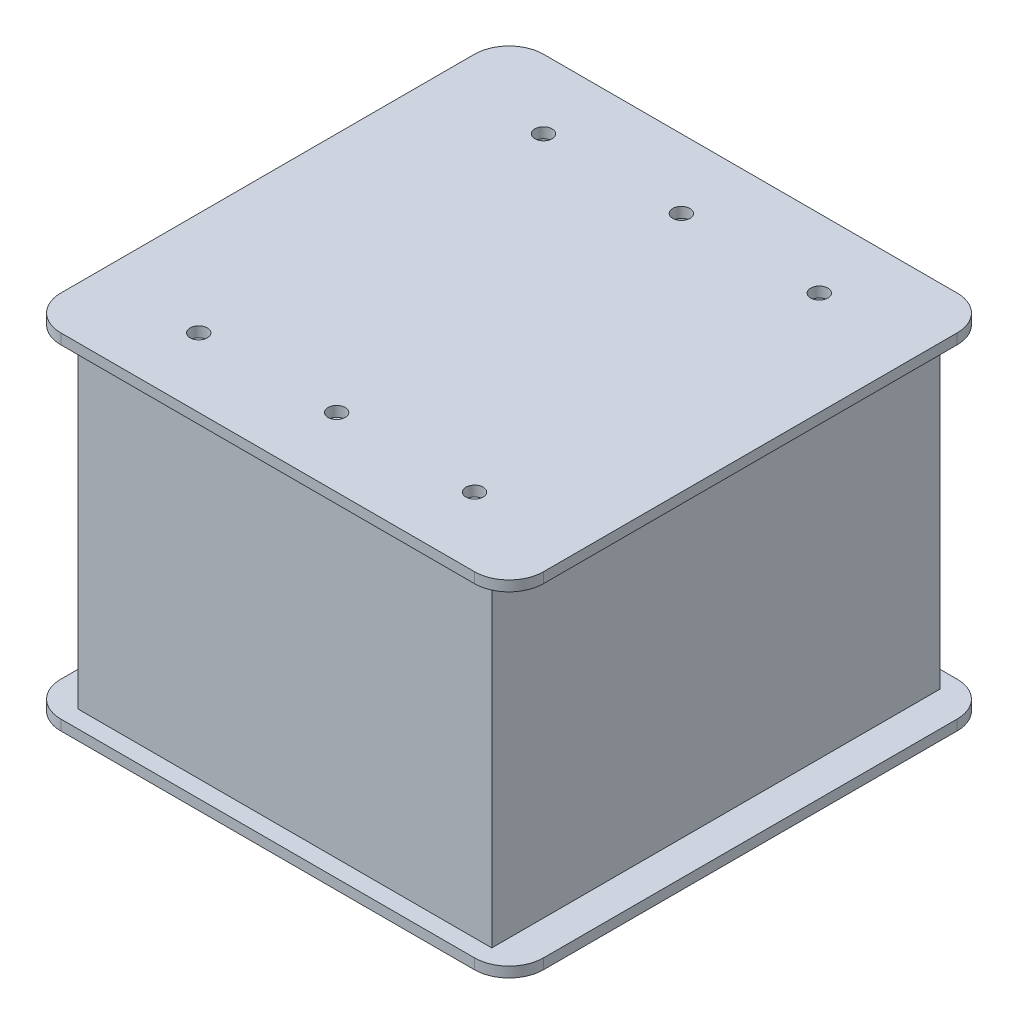
from build123d import *

# Parameters (mm, degrees)
SKETCH1_R            = 2.5
BOSS_EXTRUDE1_DEPTH  = 3
SKETCH2_W            = 120
SKETCH2_H            = 130
SKETCH2_W_2          = 114
SKETCH2_H_2          = 124
BOSS_EXTRUDE2_DEPTH  = 94
SKETCH3_R            = 2.5
BOSS_EXTRUDE3_DEPTH  = 3
BOSS_EXTRUDE6_START  = -3
SKETCH5_R            = 10
BOSS_EXTRUDE6_DEPTH  = 114
LPATTERN1_COUNT      = 5
LPATTERN1_PITCH      = 22
LPATTERN1_COUNT_DIR2 = 4
LPATTERN1_PITCH_DIR2 = 24


with BuildPart() as part:
    # Sketch1 → Boss-Extrude1 (new body)
    with BuildSketch(Plane(origin=(0, 0, 0), x_dir=(1, 0, 0), z_dir=(0, 1, 0))):
        with BuildLine():
            Line((60, 70), (-60, 70))
            ThreePointArc((-60, 70), (-67.071067812, 67.071067812), (-70, 60))
            Line((-70, 60), (-70, -60))
            ThreePointArc((-70, -60), (-67.071067812, -67.071067812), (-60, -70))
            Line((-60, -70), (60, -70))
            ThreePointArc((60, -70), (67.071067812, -67.071067812), (70, -60))
            Line((70, -60), (70, 60))
            ThreePointArc((70, 60), (67.071067812, 67.071067812), (60, 70))
        make_face()
        with Locations(Location((-40, 50, 0), (0, 0, 270))):
            Circle(SKETCH1_R, mode=Mode.SUBTRACT)
        with Locations(Location((0, 50, 0), (0, 0, 270))):
            Circle(SKETCH1_R, mode=Mode.SUBTRACT)
        with Locations(Location((40, 50, 0), (0, 0, 270))):
            Circle(SKETCH1_R, mode=Mode.SUBTRACT)
        with Locations(Location((-40, -50, 0), (0, 0, 90))):
            Circle(SKETCH1_R, mode=Mode.SUBTRACT)
        with Locations(Location((0, -50, 0), (0, 0, 90))):
            Circle(SKETCH1_R, mode=Mode.SUBTRACT)
        with Locations(Location((40, -50, 0), (0, 0, 90))):
            Circle(SKETCH1_R, mode=Mode.SUBTRACT)
    extrude(amount=BOSS_EXTRUDE1_DEPTH)

    # Sketch2 → Boss-Extrude2 (add)
    with BuildSketch(Plane(origin=(0, 3, 0), x_dir=(1, 0, 0), z_dir=(0, 1, 0))):
        Rectangle(SKETCH2_W, SKETCH2_H)
        Rectangle(SKETCH2_W_2, SKETCH2_H_2, mode=Mode.SUBTRACT)
    extrude(amount=BOSS_EXTRUDE2_DEPTH)

    # Sketch3 → Boss-Extrude3 (add)
    with BuildSketch(Plane(origin=(0, 97, 0), x_dir=(1, 0, 0), z_dir=(0, 1, 0))):
        with BuildLine():
            Line((60, 70), (-60, 70))
            ThreePointArc((-60, 70), (-67.071067812, 67.071067812), (-70, 60))
            Line((-70, 60), (-70, -60))
            ThreePointArc((-70, -60), (-67.071067812, -67.071067812), (-60, -70))
            Line((-60, -70), (60, -70))
            ThreePointArc((60, -70), (67.071067812, -67.071067812), (70, -60))
            Line((70, -60), (70, 60))
            ThreePointArc((70, 60), (67.071067812, 67.071067812), (60, 70))
        make_face()
        with Locations(Location((-40, -50, 0), (0, 0, 90))):
            Circle(SKETCH3_R, mode=Mode.SUBTRACT)
        with Locations(Location((40, 50, 0), (0, 0, 270))):
            Circle(SKETCH3_R, mode=Mode.SUBTRACT)
        with Locations(Location((0, 50, 0), (0, 0, 270))):
            Circle(SKETCH3_R, mode=Mode.SUBTRACT)
        with Locations(Location((-40, 50, 0), (0, 0, 270))):
            Circle(SKETCH3_R, mode=Mode.SUBTRACT)
        with Locations(Location((40, -50, 0), (0, 0, 90))):
            Circle(SKETCH3_R, mode=Mode.SUBTRACT)
        with Locations(Location((0, -50, 0), (0, 0, 90))):
            Circle(SKETCH3_R, mode=Mode.SUBTRACT)
    extrude(amount=BOSS_EXTRUDE3_DEPTH)


with BuildPart() as body_2:
    # Sketch5 → Boss-Extrude6 (new body)
    with BuildSketch(Plane(origin=(60, 0, 0), x_dir=(0, 0, -1), z_dir=(1, 0, 0)).offset(BOSS_EXTRUDE6_START)):
        with Locations((-45, 13)):
            Circle(SKETCH5_R)
    boss_extrude6 = extrude(amount=-BOSS_EXTRUDE6_DEPTH)


with BuildPart() as lpattern1_1:
    # LPattern1: Boss-Extrude6 5 × 4
    with Locations(*[(0, j * LPATTERN1_PITCH_DIR2, -i * LPATTERN1_PITCH) for i in range(LPATTERN1_COUNT) for j in range(LPATTERN1_COUNT_DIR2) if (i, j) != (0, 0)]):
        add(boss_extrude6)


solid = Compound([part.part, body_2.part, lpattern1_1.part])
